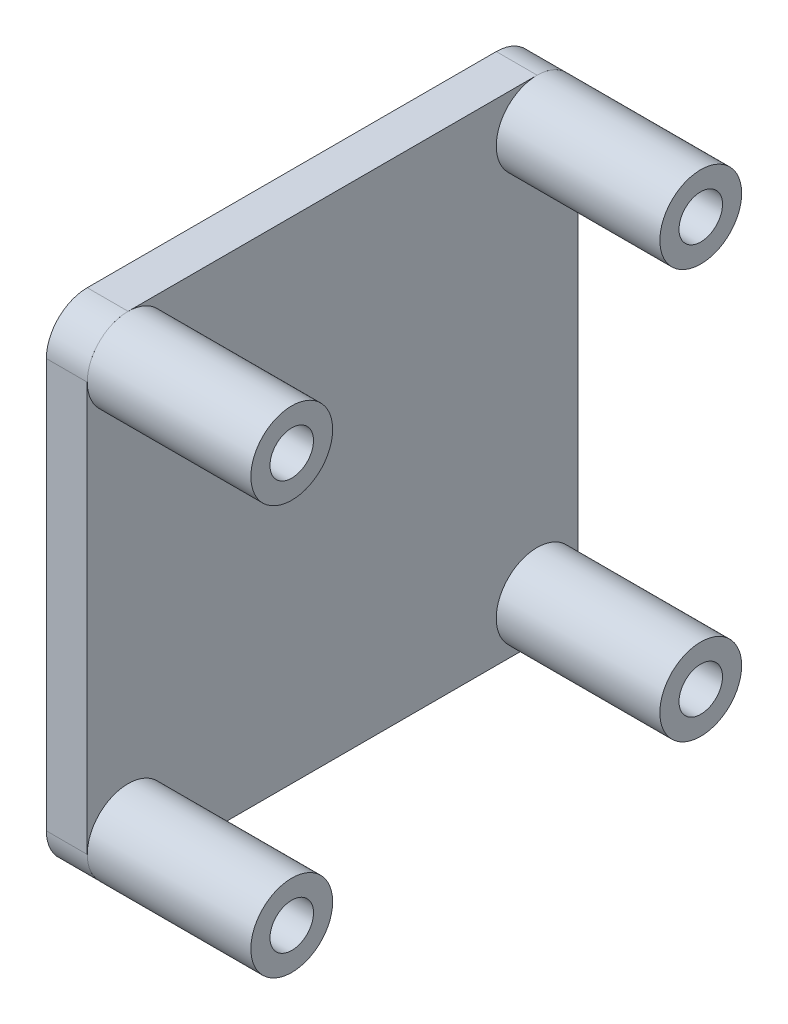
from build123d import *

# Parameters (mm, degrees)
SKETCH1_W                         = 76.2
SKETCH1_H                         = 76.2
BOSS_EXTRUDE1_DEPTH               = 6.35
FILLET1_R                         = 6.35
SKETCH3_R                         = 6.35
BOSS_EXTRUDE2_DEPTH               = 25.4
BOSS_EXTRUDE2_2_DEPTH             = 25.4
BOSS_EXTRUDE2_3_DEPTH             = 25.4
BOSS_EXTRUDE2_4_DEPTH             = 25.4
SKETCH4_W                         = 3.3782
SKETCH4_H                         = 31.75
H_0_266_DIAMETER_HOLE1_AT_2_COUNT = 2
H_0_266_DIAMETER_HOLE1_AT_2_PITCH = 89.802561211
H_0_266_DIAMETER_HOLE1_AT_3_COUNT = 2
H_0_266_DIAMETER_HOLE1_AT_3_PITCH = 63.5
H_0_266_DIAMETER_HOLE1_AT_4_COUNT = 2
H_0_266_DIAMETER_HOLE1_AT_4_PITCH = 63.5


with BuildPart() as part:
    # Sketch1 → Boss-Extrude1 (new body)
    with BuildSketch(Plane(origin=(0, 0, 0), x_dir=(0, 0, -1), z_dir=(1, 0, 0))):
        Rectangle(SKETCH1_W, SKETCH1_H)
    extrude(amount=BOSS_EXTRUDE1_DEPTH)

    # Fillet1
    fillet1_edges = [part.edges().sort_by_distance(p)[0] for p in [
        (3.175, 38.1, 38.1),
        (3.175, 38.1, -38.1),
        (3.175, -38.1, -38.1),
        (3.175, -38.1, 38.1),
    ]]
    fillet(fillet1_edges, radius=FILLET1_R)


with BuildPart() as body_2:
    # Sketch3 → Boss-Extrude2 (new body)
    with BuildSketch(Plane(origin=(6.35, 0, 0), x_dir=(0, 0, -1), z_dir=(1, 0, 0))):
        with Locations((31.75, 31.75)):
            Circle(SKETCH3_R)
    extrude(amount=BOSS_EXTRUDE2_DEPTH)


with BuildPart() as body_3:
    # Sketch3 → Boss-Extrude2 2 (new body)
    with BuildSketch(Plane(origin=(6.35, 0, 0), x_dir=(0, 0, -1), z_dir=(1, 0, 0))):
        with Locations((31.75, -31.75)):
            Circle(SKETCH3_R)
    extrude(amount=BOSS_EXTRUDE2_2_DEPTH)


with BuildPart() as body_4:
    # Sketch3 → Boss-Extrude2 3 (new body)
    with BuildSketch(Plane(origin=(6.35, 0, 0), x_dir=(0, 0, -1), z_dir=(1, 0, 0))):
        with Locations((-31.75, -31.75)):
            Circle(SKETCH3_R)
    extrude(amount=BOSS_EXTRUDE2_3_DEPTH)


with BuildPart() as body_5:
    # Sketch3 → Boss-Extrude2 4 (new body)
    with BuildSketch(Plane(origin=(6.35, 0, 0), x_dir=(0, 0, -1), z_dir=(1, 0, 0))):
        with Locations((-31.75, 31.75)):
            Circle(SKETCH3_R)
    extrude(amount=BOSS_EXTRUDE2_4_DEPTH)


with BuildPart() as h_0_266_diameter_hole1_tool:
    # Sketch4 → H (0.266) Diameter Hole1 (revolve)
    with BuildSketch(Plane(origin=(31.75, 31.75, -31.75), x_dir=(0, 0, -1), z_dir=(0, 1, 0))):
        with Locations((1.6891, 15.875)):
            Rectangle(SKETCH4_W, SKETCH4_H)
    h_0_266_diameter_hole1 = revolve(axis=Axis((38.1, 31.75, -31.75), (-1, 0, 0)))


with BuildPart() as part_1:
    add(part.part)

    # H (0.266) Diameter Hole1: cut by h_0_266_diameter_hole1_tool
    add(h_0_266_diameter_hole1_tool.part, mode=Mode.SUBTRACT)


with BuildPart() as body_2_1:
    add(body_2.part)

    # H (0.266) Diameter Hole1: cut by h_0_266_diameter_hole1_tool
    add(h_0_266_diameter_hole1_tool.part, mode=Mode.SUBTRACT)


with BuildPart() as h_0_266_diameter_hole1_at_2_tool:
    # H (0.266) Diameter Hole1 at 2: H (0.266) Diameter Hole1 ×2
    with Locations(*[Vector(0, -0.7071067811865476, 0.7071067811865475) * (i * H_0_266_DIAMETER_HOLE1_AT_2_PITCH) for i in range(1, H_0_266_DIAMETER_HOLE1_AT_2_COUNT)]):
        add(h_0_266_diameter_hole1)


with BuildPart() as part_2:
    add(part_1.part)

    # H (0.266) Diameter Hole1 at 2: cut by h_0_266_diameter_hole1_at_2_tool
    add(h_0_266_diameter_hole1_at_2_tool.part, mode=Mode.SUBTRACT)


with BuildPart() as body_4_1:
    add(body_4.part)

    # H (0.266) Diameter Hole1 at 2: cut by h_0_266_diameter_hole1_at_2_tool
    add(h_0_266_diameter_hole1_at_2_tool.part, mode=Mode.SUBTRACT)


with BuildPart() as h_0_266_diameter_hole1_at_3_tool:
    # H (0.266) Diameter Hole1 at 3: H (0.266) Diameter Hole1 ×2
    with Locations(*[(0, 0, i * H_0_266_DIAMETER_HOLE1_AT_3_PITCH) for i in range(1, H_0_266_DIAMETER_HOLE1_AT_3_COUNT)]):
        add(h_0_266_diameter_hole1)


with BuildPart() as part_3:
    add(part_2.part)

    # H (0.266) Diameter Hole1 at 3: cut by h_0_266_diameter_hole1_at_3_tool
    add(h_0_266_diameter_hole1_at_3_tool.part, mode=Mode.SUBTRACT)


with BuildPart() as body_5_1:
    add(body_5.part)

    # H (0.266) Diameter Hole1 at 3: cut by h_0_266_diameter_hole1_at_3_tool
    add(h_0_266_diameter_hole1_at_3_tool.part, mode=Mode.SUBTRACT)


with BuildPart() as h_0_266_diameter_hole1_at_4_tool:
    # H (0.266) Diameter Hole1 at 4: H (0.266) Diameter Hole1 ×2
    with Locations(*[(0, -i * H_0_266_DIAMETER_HOLE1_AT_4_PITCH, 0) for i in range(1, H_0_266_DIAMETER_HOLE1_AT_4_COUNT)]):
        add(h_0_266_diameter_hole1)


with BuildPart() as part_4:
    add(part_3.part)

    # H (0.266) Diameter Hole1 at 4: cut by h_0_266_diameter_hole1_at_4_tool
    add(h_0_266_diameter_hole1_at_4_tool.part, mode=Mode.SUBTRACT)


with BuildPart() as body_3_1:
    add(body_3.part)

    # H (0.266) Diameter Hole1 at 4: cut by h_0_266_diameter_hole1_at_4_tool
    add(h_0_266_diameter_hole1_at_4_tool.part, mode=Mode.SUBTRACT)


solid = Compound([body_2_1.part, body_4_1.part, body_5_1.part, part_4.part, body_3_1.part])
